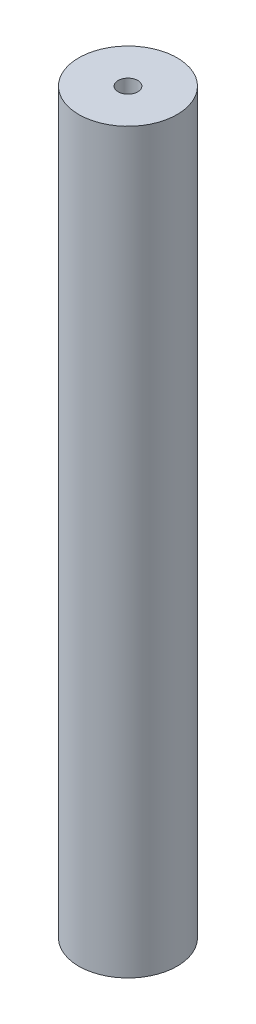
from build123d import *

# Parameters (mm, degrees)
SKETCH1_R           = 20
SKETCH1_R_2         = 4
BOSS_EXTRUDE1_DEPTH = 300


with BuildPart() as part:
    # Sketch1 → Boss-Extrude1 (new body)
    with BuildSketch(Plane(origin=(0, 0, 0), x_dir=(1, 0, 0), z_dir=(0, 1, 0))):
        with Locations(Location((0, 0, 0), (0, 0, 270))):
            Circle(SKETCH1_R)
        with Locations(Location((0, 0, 0), (0, 0, 270))):
            Circle(SKETCH1_R_2, mode=Mode.SUBTRACT)
    extrude(amount=BOSS_EXTRUDE1_DEPTH)


solid = part.part
